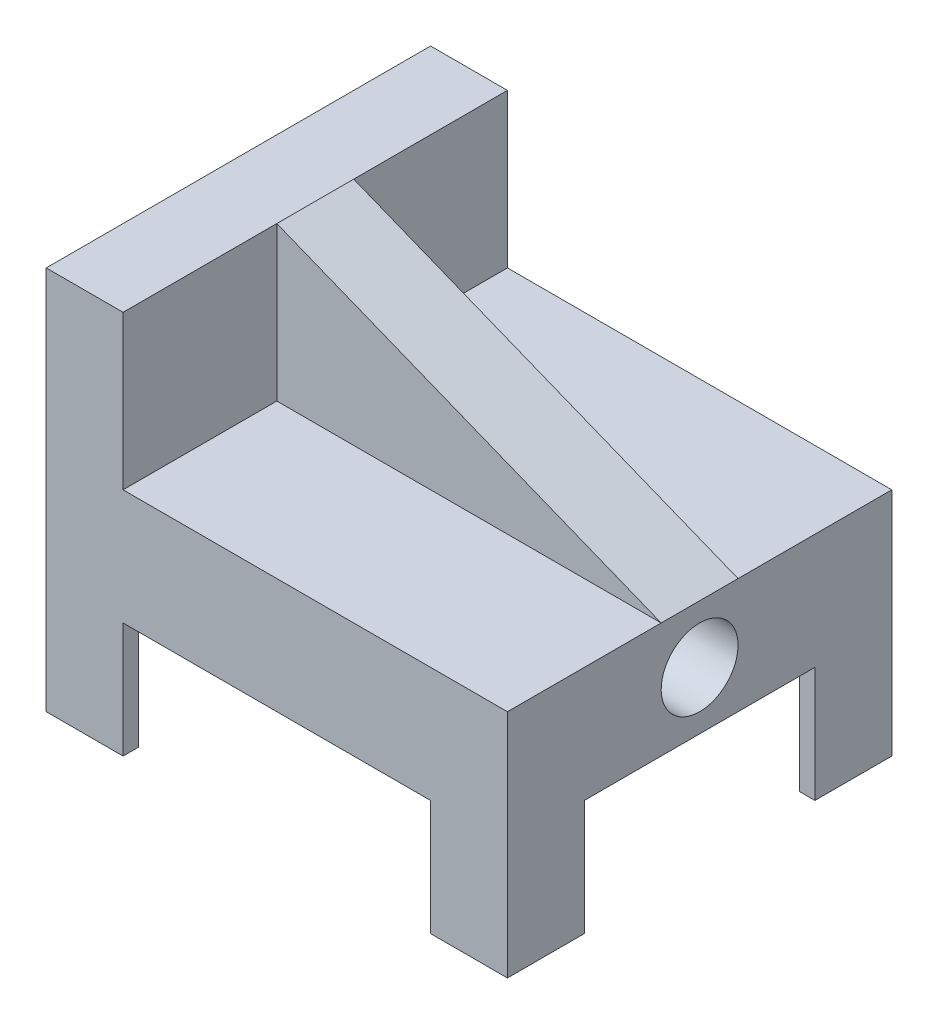
from build123d import *

# Parameters (mm, degrees)
SKETCH7_W               = 120
SKETCH7_H               = 30
BOSS_EXTRUDE4_DEPTH     = 100
SKETCH8_W               = 20
SKETCH8_H               = 100
BOSS_EXTRUDE5_DEPTH     = 40
SKETCH9_W               = 100
SKETCH9_H               = 20
BOSS_EXTRUDE6_DEPTH     = 40
CUT_EXTRUDE2_DEPTH      = 99.261072461
CUT_EXTRUDE2_DEPTH_BACK = 40
SKETCH11_R              = 10
CUT_EXTRUDE3_DEPTH      = 120
SKETCH12_W              = 4
SKETCH12_H              = 16
SKETCH12_H_2            = 4
SKETCH12_W_2            = 16
SKETCH12_W_3            = 20
SKETCH12_H_3            = 20
BOSS_EXTRUDE7_DEPTH     = 30


with BuildPart() as part:
    # Sketch7 → Boss-Extrude4 (new body)
    with BuildSketch(Plane.XY):
        with Locations((0.090771558, -5.559757943)):
            Rectangle(SKETCH7_W, SKETCH7_H)
    extrude(amount=-BOSS_EXTRUDE4_DEPTH)

    # Sketch8 → Boss-Extrude5 (add)
    with BuildSketch(Plane(origin=(0, 9.440242057, 0), x_dir=(1, 0, 0), z_dir=(0, 1, 0))):
        with Locations((-49.909228442, 50)):
            Rectangle(SKETCH8_W, SKETCH8_H)
    extrude(amount=BOSS_EXTRUDE5_DEPTH)

    # Sketch9 → Boss-Extrude6 (add)
    with BuildSketch(Plane(origin=(0, 9.440242057, 0), x_dir=(1, 0, 0), z_dir=(0, 1, 0))):
        with Locations((10.090771558, 50)):
            Rectangle(SKETCH9_W, SKETCH9_H)
    extrude(amount=BOSS_EXTRUDE6_DEPTH)

    # Sketch10 → Cut-Extrude2 (cut, two sides: drawn at the far end of the back side and taken through both)
    with BuildSketch(Plane.XY.offset(-40).offset(-CUT_EXTRUDE2_DEPTH_BACK)):
        Polygon((-284.082083156, 147.109383943), (-39.909228442, 49.440242057), (60.090771558, 9.440242057), (304.263626273, -88.228899828), (499.601910045, 400.116809601), (-88.743799385, 635.455093373), align=None)
    extrude(amount=CUT_EXTRUDE2_DEPTH + CUT_EXTRUDE2_DEPTH_BACK, mode=Mode.SUBTRACT)

    # Sketch11 → Cut-Extrude3 (cut)
    with BuildSketch(Plane(origin=(60.090771558, 0, 0), x_dir=(0, 0, -1), z_dir=(1, 0, 0))):
        with Locations(Location((50, -5.559757943, 0), (0, 0, 90))):
            Circle(SKETCH11_R)
    extrude(amount=-CUT_EXTRUDE3_DEPTH, mode=Mode.SUBTRACT)

    # Sketch12 → Boss-Extrude7 (add)
    with BuildSketch(Plane.XZ.offset(20.559757943)):
        with Locations((-57.909228442, -12)):
            Rectangle(SKETCH12_W, SKETCH12_H)
        with Locations((-57.909228442, -2)):
            Rectangle(SKETCH12_W, SKETCH12_H_2)
        with Locations((-47.909228442, -2)):
            Rectangle(SKETCH12_W_2, SKETCH12_H_2)
        with Locations((48.090771558, -2)):
            Rectangle(SKETCH12_W_2, SKETCH12_H_2)
        with Locations((58.090771558, -12)):
            Rectangle(SKETCH12_W, SKETCH12_H)
        with Locations((58.090771558, -2)):
            Rectangle(SKETCH12_W, SKETCH12_H_2)
        with Locations((58.090771558, -88)):
            Rectangle(SKETCH12_W, SKETCH12_H)
        with Locations((58.090771558, -98)):
            Rectangle(SKETCH12_W, SKETCH12_H_2)
        with Locations((48.090771558, -98)):
            Rectangle(SKETCH12_W_2, SKETCH12_H_2)
        with Locations((-49.909228442, -98)):
            Rectangle(SKETCH12_W_3, SKETCH12_H_2)
        with Locations((-57.909228442, -90)):
            Rectangle(SKETCH12_W, SKETCH12_H_3)
    extrude(amount=BOSS_EXTRUDE7_DEPTH)


solid = part.part
